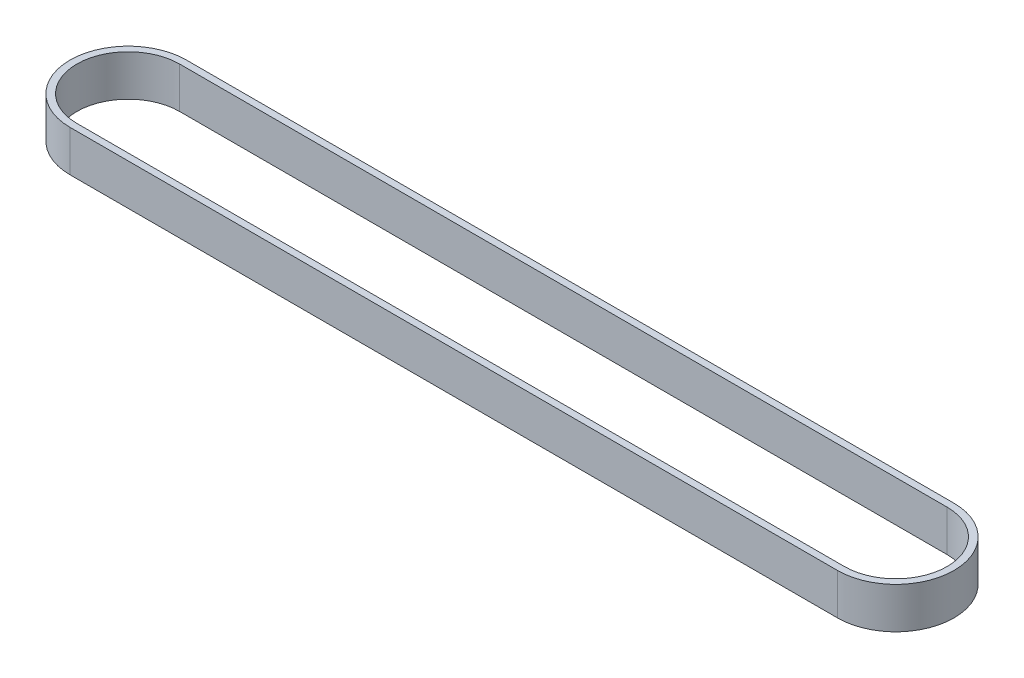
from build123d import *

# Parameters (mm, degrees)
BOSS_EXTRUDE3_DEPTH = 6


with BuildPart() as part:
    # Sketch4 → Boss-Extrude3 (new body)
    with BuildSketch(Plane(origin=(0, 0, 0), x_dir=(1, 0, 0), z_dir=(0, 1, 0))):
        with BuildLine():
            Line((0, 8.5), (112, 8.5))
            ThreePointArc((112, 8.5), (120.5, 0), (112, -8.5))
            Line((112, -8.5), (0, -8.5))
            ThreePointArc((0, -8.5), (-8.5, 0), (0, 8.5))
        make_face()
        with BuildLine():
            Line((0, 7.5), (112, 7.5))
            ThreePointArc((112, 7.5), (119.5, 0), (112, -7.5))
            Line((112, -7.5), (0, -7.5))
            ThreePointArc((0, -7.5), (-7.5, 0), (0, 7.5))
        make_face(mode=Mode.SUBTRACT)
    extrude(amount=BOSS_EXTRUDE3_DEPTH)


solid = part.part
